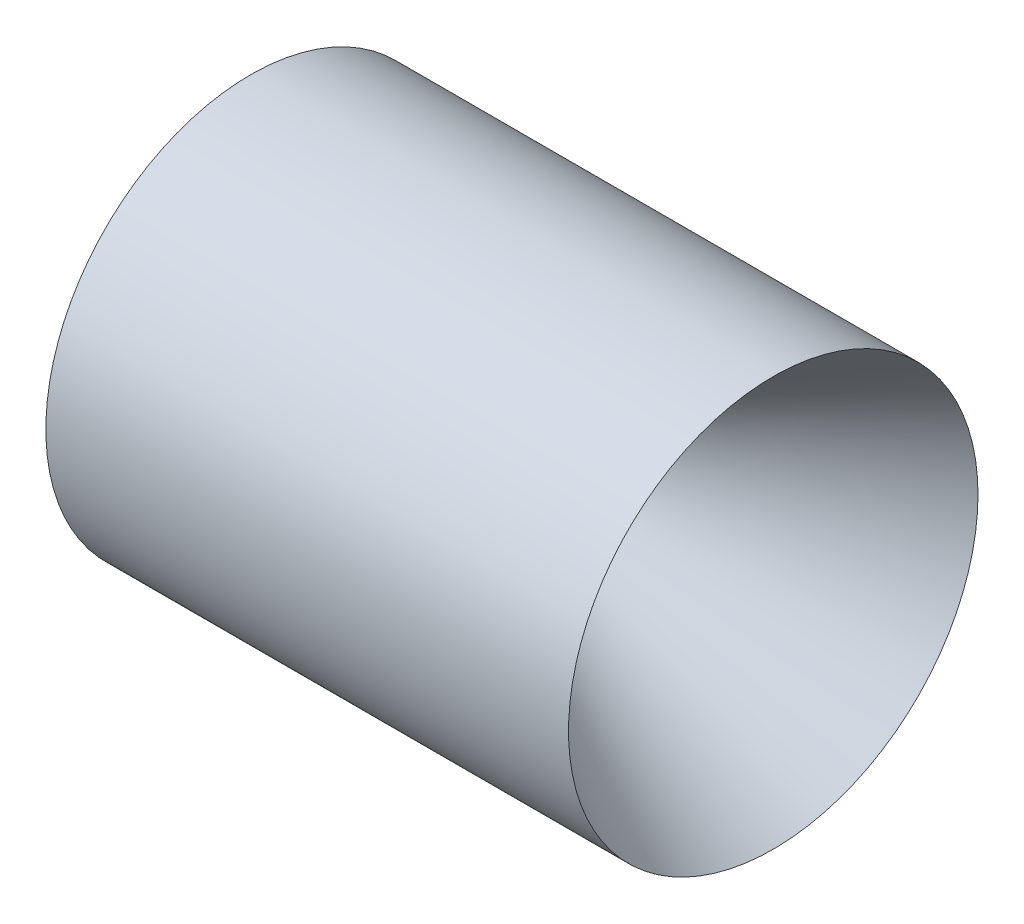
from build123d import *


with BuildPart() as part:
    # Sketch1 → Revolve1 (revolve)
    with BuildSketch(Plane.XY, mode=Mode.PRIVATE) as revolve1_sk:
        Polygon((-85.972771196, 17.5), (-41.296375432, 17.5), (-62.947010526, 5), (-63.720074084, 5), (-85.972771196, 10.96259222), align=None)
    revolve(revolve1_sk.sketch.rotate(Axis((11.272384543, 0, 0), (-1, 0, 0)), 90), axis=Axis((11.272384543, 0, 0), (-1, 0, 0)))


solid = part.part
